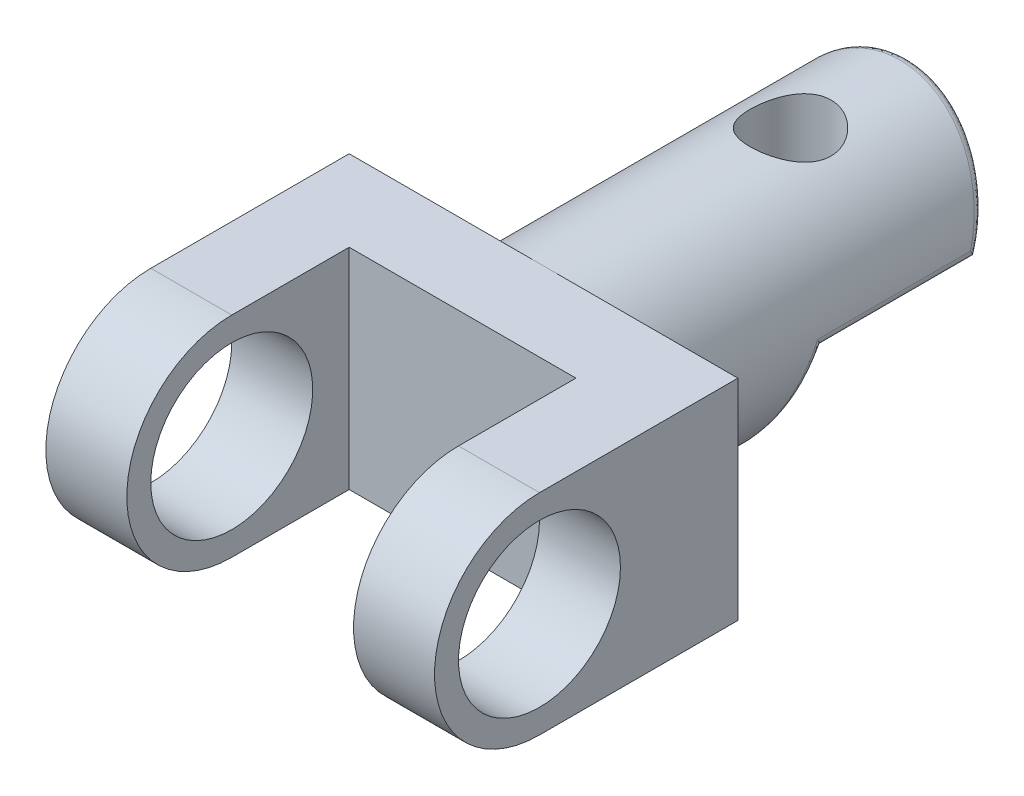
from build123d import *

# Parameters (mm, degrees)
CUT_EXTRUDE_1_DEPTH      = 96.582051988
CUT_EXTRUDE_1_DEPTH_BACK = 96.582051988
FILLET_1_R               = 0.25
SKETCH_4_R               = 1.25
CUT_EXTRUDE_2_DEPTH      = 85.125637832
SKETCH_5_R               = 2.5
EXTRUDE_1_DEPTH          = 6
SKETCH_6_W               = 7
SKETCH_6_H               = 13.635845178
CUT_EXTRUDE_3_DEPTH      = 104.240069036


with BuildPart() as part:
    # 草图1 → 旋转1 (revolve)
    with BuildSketch(Plane(origin=(0, -42.25, 0), x_dir=(1, 0, 0), z_dir=(0, 1, 0)), mode=Mode.PRIVATE) as revolve_1_sk:
        Polygon((57.25, -47), (57.25, -53), (57.25, -58.375), (60.489565186, -58.375), (60.489565186, -47), align=None)
    revolve(revolve_1_sk.sketch.rotate(Axis((57.25, -42.25, 47), (0, 0, 1)), 180), axis=Axis((57.25, -42.25, 47), (0, 0, 1)))

    # 草图2 → 切除-拉伸1 (cut, two sides: drawn at the far end of the back side and taken through both)
    with BuildSketch(Plane(origin=(0, 0, 0), x_dir=(0, 0, -1), z_dir=(1, 0, 0)).offset(-CUT_EXTRUDE_1_DEPTH_BACK)):
        Polygon((-48.25, -42.25), (-53, -42.25), (-54.875, -45.5), (-45.95593144, -45.5), (-45.95593144, -39), (-47, -39), align=None)
    extrude(amount=CUT_EXTRUDE_1_DEPTH + CUT_EXTRUDE_1_DEPTH_BACK, mode=Mode.SUBTRACT)

    # 圆角1
    fillet_1_edges = [part.edges().sort_by_distance(p)[0] for p in [
        (57.250000001, -39.010434814, 47.00401339),
        (54.010434814, -42.25, 50.625),
        (57.249999966, -45.489565186, 54.868979915),
        (60.489565186, -42.25, 50.625),
    ]]
    fillet(fillet_1_edges, radius=FILLET_1_R)

    # 草图4 → 切除-拉伸2 (cut, through all)
    with BuildSketch(Plane.XZ.offset(42.25)):
        with Locations(Location((57.25, 50.75, 0), (0, 0, 270))):
            Circle(SKETCH_4_R)
    extrude(amount=-CUT_EXTRUDE_2_DEPTH, mode=Mode.SUBTRACT)

    # 草图5 → 凸台-拉伸1 (add, symmetric)
    with BuildSketch(Plane(origin=(57.25, 0, 0), x_dir=(0, 0, -1), z_dir=(1, 0, 0))):
        with BuildLine():
            Line((-64.5, -45.489565186), (-58.375, -45.489565186))
            Line((-58.375, -45.489565186), (-58.375, -39.010434814))
            Line((-58.375, -39.010434814), (-64.5, -39.010434814))
            ThreePointArc((-64.5, -39.010434814), (-67.739565186, -42.25), (-64.5, -45.489565186))
        make_face()
        with Locations((-64.5, -42.25)):
            Circle(SKETCH_5_R, mode=Mode.SUBTRACT)
    extrude(amount=EXTRUDE_1_DEPTH, both=True)

    # 草图6 → 切除-拉伸3 (cut, through all)
    with BuildSketch(Plane(origin=(0, 0, 0), x_dir=(1, 0, 0), z_dir=(0, 1, 0))):
        with Locations((57.25, -67.692922589)):
            Rectangle(SKETCH_6_W, SKETCH_6_H)
    extrude(amount=-CUT_EXTRUDE_3_DEPTH, mode=Mode.SUBTRACT)


solid = part.part
